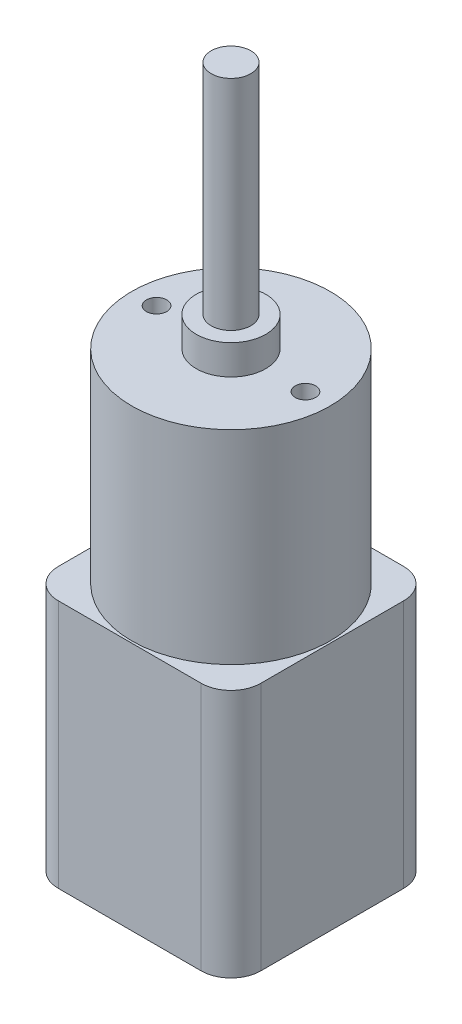
from build123d import *

# Parameters (mm, degrees)
SKETCH2_W               = 20.4
SKETCH2_H               = 20.4
BOSS_EXTRUDE1_DEPTH     = 25.1
SKETCH3_R               = 10
BOSS_EXTRUDE2_DEPTH     = 20.5
SKETCH4_R               = 3.5
BOSS_EXTRUDE3_DEPTH     = 3
SKETCH5_R               = 2
BOSS_EXTRUDE4_DEPTH     = 22
M2_5_TAPPED_HOLE1_D     = 2.05
M2_5_TAPPED_HOLE1_DEPTH = 5
M2_5_TAPPED_HOLE1_TIP   = 0.615882135
FILLET1_R               = 3


with BuildPart() as part:
    # Sketch2 → Boss-Extrude1 (new body)
    with BuildSketch(Plane(origin=(0, 0, 0), x_dir=(1, 0, 0), z_dir=(0, 1, 0))):
        Rectangle(SKETCH2_W, SKETCH2_H)
    extrude(amount=BOSS_EXTRUDE1_DEPTH)

    # Sketch3 → Boss-Extrude2 (add)
    with BuildSketch(Plane(origin=(0, 25.1, 0), x_dir=(1, 0, 0), z_dir=(0, 1, 0))):
        with Locations(Location((0, 0, 0), (0, 0, 270))):
            Circle(SKETCH3_R)
    extrude(amount=BOSS_EXTRUDE2_DEPTH)

    # Sketch4 → Boss-Extrude3 (add)
    with BuildSketch(Plane(origin=(0, 45.6, 0), x_dir=(1, 0, 0), z_dir=(0, 1, 0))):
        with Locations(Location((0, 0, 0), (0, 0, 270))):
            Circle(SKETCH4_R)
    extrude(amount=BOSS_EXTRUDE3_DEPTH)

    # Sketch5 → Boss-Extrude4 (add)
    with BuildSketch(Plane(origin=(0, 48.6, 0), x_dir=(1, 0, 0), z_dir=(0, 1, 0))):
        with Locations(Location((0, 0, 0), (0, 0, 270))):
            Circle(SKETCH5_R)
    extrude(amount=BOSS_EXTRUDE4_DEPTH)

    # M2.5 Tapped Hole1
    with Locations(Plane(origin=(0, 45.6, 0), x_dir=(1, 0, 0), z_dir=(0, 1, 0))):
        with Locations((-7.5, 0), (7.5, 0)):
            Hole(M2_5_TAPPED_HOLE1_D / 2, depth=M2_5_TAPPED_HOLE1_DEPTH)
            with Locations((0, 0, -(M2_5_TAPPED_HOLE1_DEPTH + M2_5_TAPPED_HOLE1_TIP / 2))):  # 118° drill point
                Cone(0, M2_5_TAPPED_HOLE1_D / 2, M2_5_TAPPED_HOLE1_TIP, mode=Mode.SUBTRACT)

    # Fillet1
    fillet1_edges = [part.edges().sort_by_distance(p)[0] for p in [
        (10.2, 12.55, 10.2),
        (-10.2, 12.55, 10.2),
        (-10.2, 12.55, -10.2),
        (10.2, 12.55, -10.2),
    ]]
    fillet(fillet1_edges, radius=FILLET1_R)


solid = part.part
